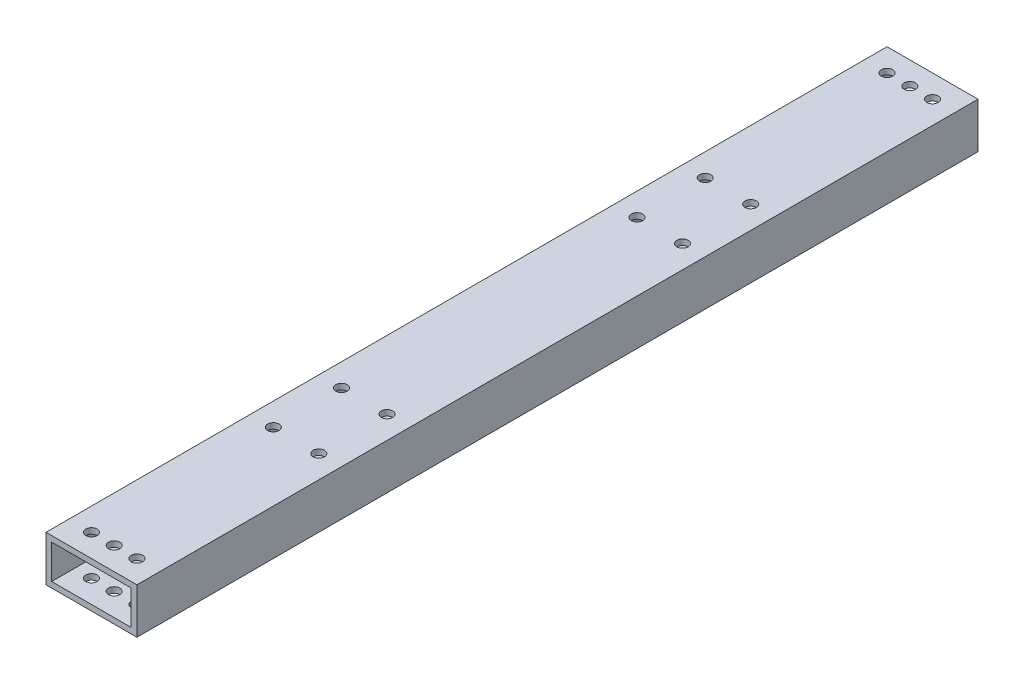
from build123d import *

# Parameters (mm, degrees)
SKETCH1_W               = 50.8
SKETCH1_H               = 25.4
SKETCH1_W_2             = 44.45
SKETCH1_H_2             = 19.05
BOSS_EXTRUDE1_DEPTH     = 469.9
CUT_EXTRUDE1_DEPTH      = 474.319986901
CUT_EXTRUDE1_DEPTH_BACK = 474.319986901
SKETCH3_R               = 3.175
CUT_EXTRUDE2_DEPTH      = 474.319986901
CUT_EXTRUDE2_DEPTH_BACK = 474.319986901
SKETCH4_R               = 3.175


with BuildPart() as part:
    # Sketch1 → Boss-Extrude1 (new body)
    with BuildSketch(Plane.XY):
        with Locations((25.4, 12.7)):
            Rectangle(SKETCH1_W, SKETCH1_H)
        with Locations((25.4, 12.7)):
            Rectangle(SKETCH1_W_2, SKETCH1_H_2, mode=Mode.SUBTRACT)
    extrude(amount=BOSS_EXTRUDE1_DEPTH)

    # Sketch3 → Cut-Extrude1 (cut, two sides: drawn at the far end of the back side and taken through both)
    with BuildSketch(Plane(origin=(0, 25.4, 0), x_dir=(1, 0, 0), z_dir=(0, 1, 0)).offset(-CUT_EXTRUDE1_DEPTH_BACK)):
        with Locations(Location((12.7, -12.7, 0), (0, 0, 270))):
            Circle(SKETCH3_R)
        with Locations(Location((12.7, -457.2, 0), (0, 0, 270))):
            Circle(SKETCH3_R)
        with Locations(Location((25.4, -457.2, 0), (0, 0, 270))):
            Circle(SKETCH3_R)
        with Locations(Location((25.4, -12.7, 0), (0, 0, 270))):
            Circle(SKETCH3_R)
        with Locations(Location((38.1, -457.2, 0), (0, 0, 270))):
            Circle(SKETCH3_R)
        with Locations(Location((38.1, -12.7, 0), (0, 0, 270))):
            Circle(SKETCH3_R)
    extrude(amount=CUT_EXTRUDE1_DEPTH + CUT_EXTRUDE1_DEPTH_BACK, mode=Mode.SUBTRACT)

    # Sketch4 → Cut-Extrude2 (cut, two sides: drawn at the far end of the back side and taken through both)
    with BuildSketch(Plane(origin=(0, 25.4, 0), x_dir=(1, 0, 0), z_dir=(0, 1, 0)).offset(-CUT_EXTRUDE2_DEPTH_BACK)):
        with Locations(Location((12.7, -152.4, 0), (0, 0, 90))):
            Circle(SKETCH4_R)
        with Locations(Location((12.7, -317.5, 0), (0, 0, 90))):
            Circle(SKETCH4_R)
        with Locations(Location((12.7, -114.3, 0), (0, 0, 90))):
            Circle(SKETCH4_R)
        with Locations(Location((12.7, -355.6, 0), (0, 0, 90))):
            Circle(SKETCH4_R)
        with Locations(Location((38.1, -114.3, 0), (0, 0, 90))):
            Circle(SKETCH4_R)
        with Locations(Location((38.1, -152.4, 0), (0, 0, 90))):
            Circle(SKETCH4_R)
        with Locations(Location((38.1, -317.5, 0), (0, 0, 90))):
            Circle(SKETCH4_R)
        with Locations(Location((38.1, -355.6, 0), (0, 0, 90))):
            Circle(SKETCH4_R)
    extrude(amount=CUT_EXTRUDE2_DEPTH + CUT_EXTRUDE2_DEPTH_BACK, mode=Mode.SUBTRACT)


solid = part.part
